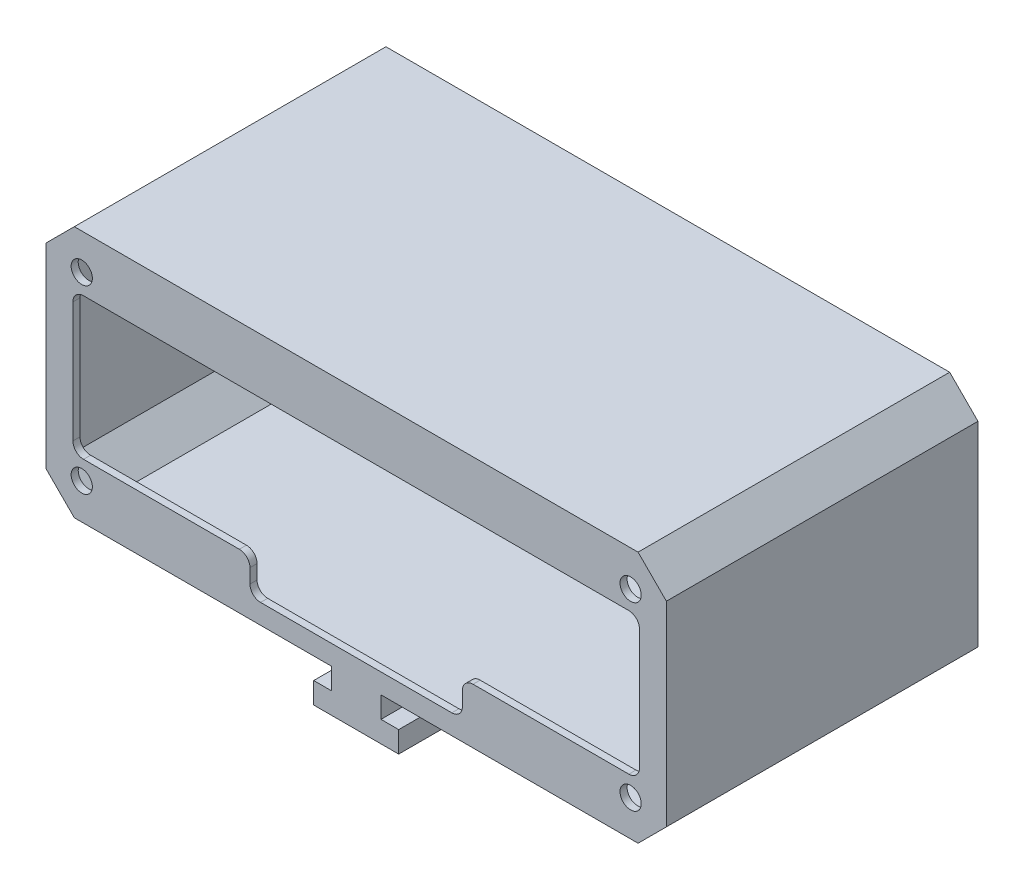
from build123d import *

# Parameters (mm, degrees)
SKETCH_1_W          = 87.6
SKETCH_1_H          = 35.6
SKETCH_1_W_2        = 86
SKETCH_1_H_2        = 34
EXTRUDE_1_DEPTH     = 43
CHAMFER_1_SIZE      = 4
EXTRUDE_2_DEPTH     = 1
CUT_EXTRUDE_1_DEPTH = 65.585447277
FILLET_1_R          = 1.5
SKETCH_4_R          = 1.5
CUT_EXTRUDE_2_DEPTH = 64.908371909
SKETCH_5_W          = 12
SKETCH_5_H          = 44
EXTRUDE_3_DEPTH     = 6
SKETCH_6_W          = 2.5
SKETCH_6_H          = 3
CUT_EXTRUDE_3_DEPTH = 67.48969845
SKETCH_7_R          = 4
CUT_EXTRUDE_4_DEPTH = 2.2


with BuildPart() as part:
    # 草圖1 → 填料-伸長1 (new body)
    with BuildSketch(Plane.XY):
        Rectangle(SKETCH_1_W, SKETCH_1_H)
        Rectangle(SKETCH_1_W_2, SKETCH_1_H_2, mode=Mode.SUBTRACT)
    extrude(amount=EXTRUDE_1_DEPTH)

    # 導角1
    chamfer_1_edges = [part.edges().sort_by_distance(p)[0] for p in [
        (-43, 17, 21.5),
        (-43, -17, 21.5),
        (43, -17, 21.5),
        (43, 17, 21.5),
        (-43.8, 17.8, 21.5),
        (43.8, 17.8, 21.5),
        (43.8, -17.8, 21.5),
        (-43.8, -17.8, 21.5),
    ]]
    chamfer(chamfer_1_edges, length=CHAMFER_1_SIZE)

    # 草圖2 → 填料-伸長2 (add)
    with BuildSketch(Plane.XY.offset(43)):
        Polygon((-43.8, 13.8), (-39.8, 17.8), (39.8, 17.8), (43.8, 13.8), (43.8, -13.8), (39.8, -17.8), (-39.8, -17.8), (-43.8, -13.8), align=None)
    extrude(amount=EXTRUDE_2_DEPTH)

    # 草圖3 → 除料-伸長1 (cut, through all)
    with BuildSketch(Plane.XY.offset(44)):
        Polygon((15, -10), (40, -10), (40, 10), (-40, 10), (-40, -10), (-15, -10), (-15, -15), (15, -15), align=None)
    extrude(amount=-CUT_EXTRUDE_1_DEPTH, mode=Mode.SUBTRACT)

    # 圓角1
    fillet_1_edges = [part.edges().sort_by_distance(p)[0] for p in [
        (-40, -10, 43.5),
        (-40, 10, 43.5),
        (40, 10, 43.5),
        (40, -10, 43.5),
        (15, -10, 43.5),
        (15, -15, 43.5),
        (-15, -15, 43.5),
        (-15, -10, 43.5),
    ]]
    fillet(fillet_1_edges, radius=FILLET_1_R)

    # 草圖4 → 除料-伸長2 (cut, through all)
    with BuildSketch(Plane(origin=(0, 0, 43), x_dir=(-1, 0, 0), z_dir=(0, 0, -1))):
        with Locations((-38.75, 12.75)):
            Circle(SKETCH_4_R)
        with Locations(Location((38.75, 12.75, 0), (0, 0, 180))):
            Circle(SKETCH_4_R)
        with Locations((38.75, -12.75)):
            Circle(SKETCH_4_R)
        with Locations(Location((-38.75, -12.75, 0), (0, 0, 180))):
            Circle(SKETCH_4_R)
    extrude(amount=-CUT_EXTRUDE_2_DEPTH, mode=Mode.SUBTRACT)

    # 草圖5 → 填料-伸長3 (add)
    with BuildSketch(Plane.XZ.offset(17.8)):
        with Locations((0, 22)):
            Rectangle(SKETCH_5_W, SKETCH_5_H)
    extrude(amount=EXTRUDE_3_DEPTH)

    # 草圖6 → 除料-伸長3 (cut, through all)
    with BuildSketch(Plane.XY.offset(44)):
        with Locations((4.75, -19.3)):
            Rectangle(SKETCH_6_W, SKETCH_6_H)
        with Locations((-4.75, -19.3)):
            Rectangle(SKETCH_6_W, SKETCH_6_H)
    extrude(amount=-CUT_EXTRUDE_3_DEPTH, mode=Mode.SUBTRACT)

    # 草圖7 → 除料-伸長4 (cut)
    with BuildSketch(Plane.XZ.offset(23.8)):
        with Locations(Location((0, 6, 0), (0, 0, 270))):
            Circle(SKETCH_7_R)
        with Locations(Location((0, 21, 0), (0, 0, 270))):
            Circle(SKETCH_7_R)
        with Locations(Location((0, 36, 0), (0, 0, 270))):
            Circle(SKETCH_7_R)
    extrude(amount=-CUT_EXTRUDE_4_DEPTH, mode=Mode.SUBTRACT)


solid = part.part
